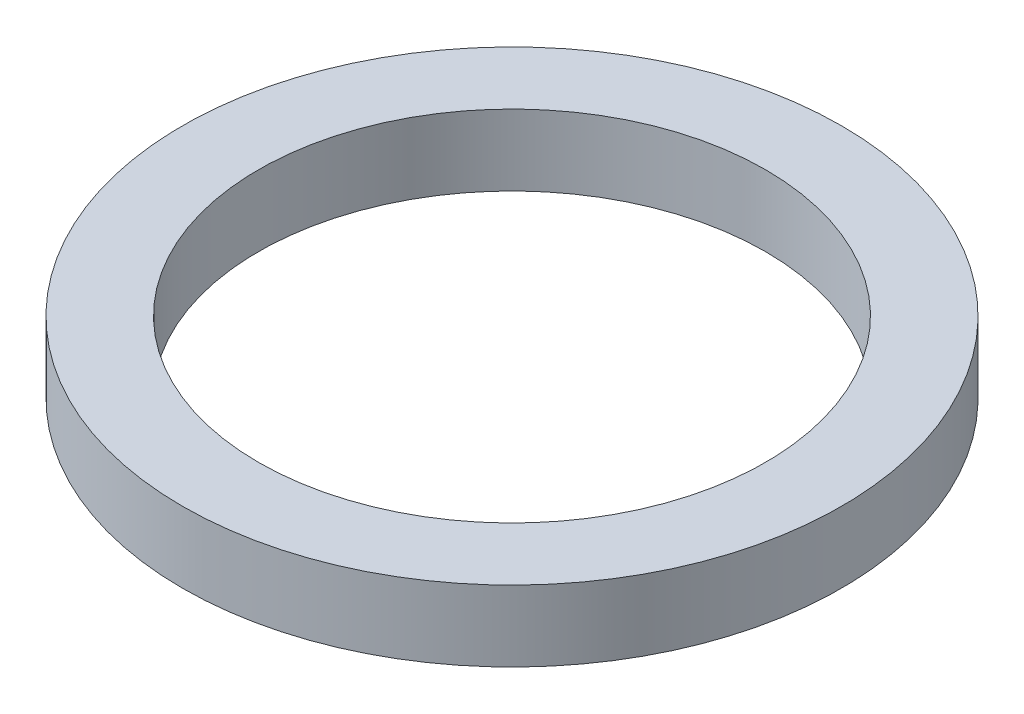
from build123d import *

# Parameters (mm, degrees)
SKETCH1_R           = 32.5
SKETCH1_R_2         = 25
BOSS_EXTRUDE1_DEPTH = 3.5


with BuildPart() as part:
    # Sketch1 → Boss-Extrude1 (new, symmetric)
    with BuildSketch(Plane(origin=(0, 0, 0), x_dir=(1, 0, 0), z_dir=(0, 1, 0))):
        with Locations(Location((0, 0, 0), (0, 0, 270))):
            Circle(SKETCH1_R)
        with Locations(Location((0, 0, 0), (0, 0, 270))):
            Circle(SKETCH1_R_2, mode=Mode.SUBTRACT)
    extrude(amount=BOSS_EXTRUDE1_DEPTH, both=True)


solid = part.part
